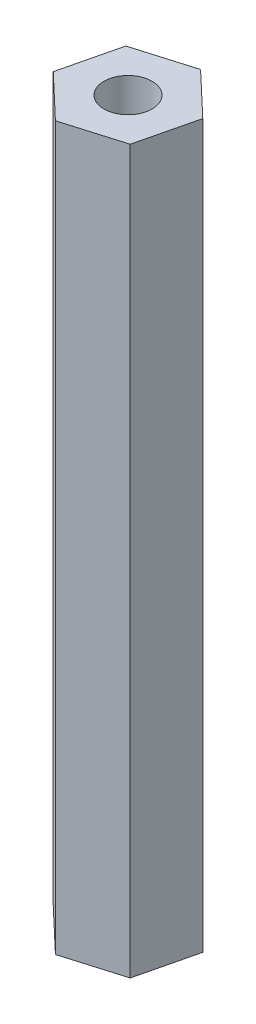
from build123d import *

# Parameters (mm, degrees)
EXTRUDE_THIN1_DEPTH = 60
SKETCH2_R           = 4
SKETCH2_R_2         = 2
EXTRUDE_THIN2_DEPTH = 60


with BuildPart() as part:
    # Sketch1 → Extrude-Thin1 (new body)
    with BuildSketch(Plane(origin=(0, 0, 0), x_dir=(1, 0, 0), z_dir=(0, 1, 0))):
        Polygon((3.624997168, -3.44374731), (4.794871238, 1.417465981), (1.16987407, 4.861213291), (-3.624997168, 3.44374731), (-4.794871238, -1.417465981), (-1.16987407, -4.861213291), align=None)
        Polygon((1.950682695, -1.853148561), (2.580215078, 0.762766489), (0.629532383, 2.615915049), (-1.950682695, 1.853148561), (-2.580215078, -0.762766489), (-0.629532383, -2.615915049), align=None, mode=Mode.SUBTRACT)
    extrude(amount=EXTRUDE_THIN1_DEPTH)

    # Sketch2 → Extrude-Thin2 (add)
    with BuildSketch(Plane(origin=(0, 60, 0), x_dir=(1, 0, 0), z_dir=(0, 1, 0))):
        Circle(SKETCH2_R)
        Circle(SKETCH2_R_2, mode=Mode.SUBTRACT)
    extrude(amount=-EXTRUDE_THIN2_DEPTH)


solid = part.part
